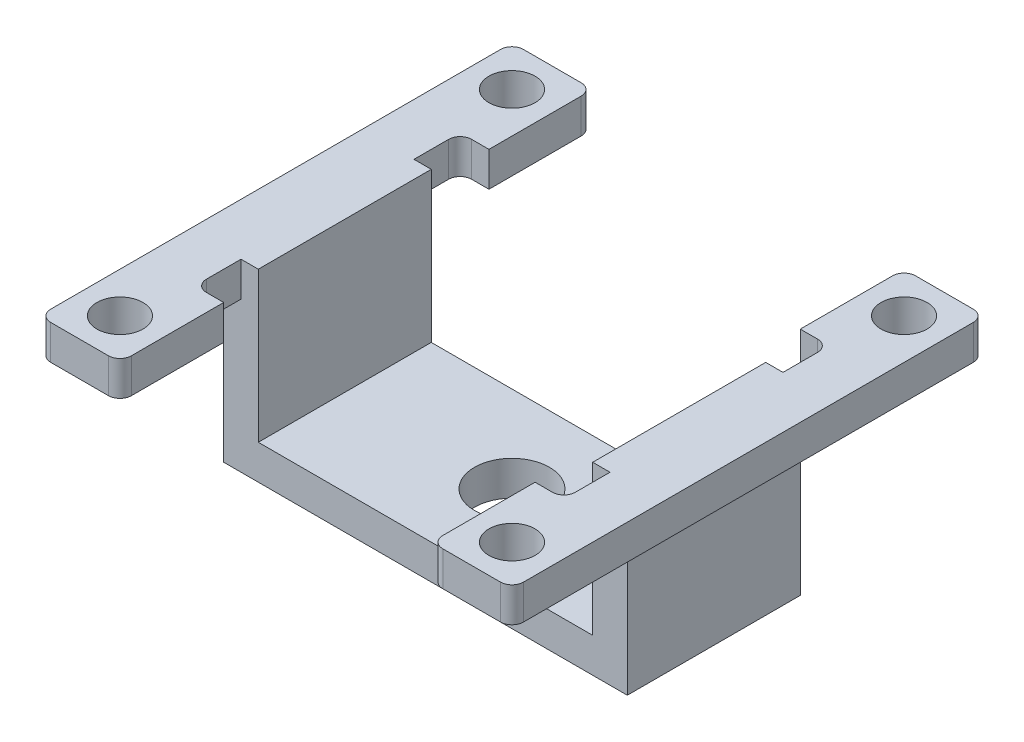
from build123d import *

# Parameters (mm, degrees)
SKETCH_1_R      = 3.25
EXTRUDE_1_DEPTH = 3
SKETCH_2_W      = 3
SKETCH_2_H      = 15
EXTRUDE_2_DEPTH = 10
SKETCH_3_R      = 2
EXTRUDE_3_DEPTH = 3


with BuildPart() as part:
    # 草图1 → 凸台-拉伸1 (new body)
    with BuildSketch(Plane(origin=(0, 0, 0), x_dir=(1, 0, 0), z_dir=(0, 1, 0))):
        Polygon((-12.5, 7.5), (12.5, 7.5), (17.5, 7.5), (17.5, -7.5), (12.5, -7.5), (-12.5, -7.5), (-17.5, -7.5), (-17.5, 7.5), align=None)
        with Locations(Location((0, 0, 0), (0, 0, 270))):
            Circle(SKETCH_1_R, mode=Mode.SUBTRACT)
    extrude(amount=EXTRUDE_1_DEPTH)

    # 草图2 → 凸台-拉伸2 (add)
    with BuildSketch(Plane(origin=(0, 3, 0), x_dir=(1, 0, 0), z_dir=(0, 1, 0))):
        with Locations((-16, 0)):
            Rectangle(SKETCH_2_W, SKETCH_2_H)
        with Locations((16, 0)):
            Rectangle(SKETCH_2_W, SKETCH_2_H)
    extrude(amount=EXTRUDE_2_DEPTH)

    # 草图3 → 凸台-拉伸3 (add)
    # profile 1 of 2: a face of its own
    with BuildSketch(Plane(origin=(0, 13, 0), x_dir=(1, 0, 0), z_dir=(0, 1, 0))):
        with BuildLine():
            Line((-15, -11.5), (-13.5, -11.5))
            Line((-13.5, -11.5), (-13.5, -17.5))
            Line((-13.5, -17.5), (-13.5, -19.5))
            ThreePointArc((-13.5, -19.5), (-13.792893219, -20.207106781), (-14.5, -20.5))
            Line((-14.5, -20.5), (-19.5, -20.5))
            ThreePointArc((-19.5, -20.5), (-20.207106781, -20.207106781), (-20.5, -19.5))
            Line((-20.5, -19.5), (-20.5, 19.5))
            ThreePointArc((-20.5, 19.5), (-20.207106781, 20.207106781), (-19.5, 20.5))
            Line((-19.5, 20.5), (-14.5, 20.5))
            ThreePointArc((-14.5, 20.5), (-13.792893219, 20.207106781), (-13.5, 19.5))
            Line((-13.5, 19.5), (-13.5, 18.5))
            Line((-13.5, 18.5), (-13.5, 11.5))
            Line((-13.5, 11.5), (-15, 11.5))
            ThreePointArc((-15, 11.5), (-15.707106781, 11.207106781), (-16, 10.5))
            Line((-16, 10.5), (-16, 7.5))
            Line((-16, 7.5), (-14.5, 7.5))
            Line((-14.5, 7.5), (-14.5, -7.5))
            Line((-14.5, -7.5), (-16, -7.5))
            Line((-16, -7.5), (-16, -10.5))
            ThreePointArc((-16, -10.5), (-15.707106781, -11.207106781), (-15, -11.5))
        make_face()
        with Locations(Location((-17, 17, 0), (0, 0, 270))):
            Circle(SKETCH_3_R, mode=Mode.SUBTRACT)
        with Locations(Location((-17, -17, 0), (0, 0, 90))):
            Circle(SKETCH_3_R, mode=Mode.SUBTRACT)
    # profile 2 of 2: a face of its own
    with BuildSketch(Plane(origin=(0, 13, 0), x_dir=(1, 0, 0), z_dir=(0, 1, 0))):
        with BuildLine():
            Line((14.5, 7.5), (16, 7.5))
            Line((16, 7.5), (16, 10.5))
            ThreePointArc((16, 10.5), (15.707106781, 11.207106781), (15, 11.5))
            Line((15, 11.5), (13.5, 11.5))
            Line((13.5, 11.5), (13.5, 18.5))
            Line((13.5, 18.5), (13.5, 19.5))
            ThreePointArc((13.5, 19.5), (13.792893219, 20.207106781), (14.5, 20.5))
            Line((14.5, 20.5), (19.5, 20.5))
            ThreePointArc((19.5, 20.5), (20.207106781, 20.207106781), (20.5, 19.5))
            Line((20.5, 19.5), (20.5, -19.5))
            ThreePointArc((20.5, -19.5), (20.207106781, -20.207106781), (19.5, -20.5))
            Line((19.5, -20.5), (14.5, -20.5))
            ThreePointArc((14.5, -20.5), (13.792893219, -20.207106781), (13.5, -19.5))
            Line((13.5, -19.5), (13.5, -18.5))
            Line((13.5, -18.5), (13.5, -11.5))
            Line((13.5, -11.5), (15, -11.5))
            ThreePointArc((15, -11.5), (15.707106781, -11.207106781), (16, -10.5))
            Line((16, -10.5), (16, -7.5))
            Line((16, -7.5), (14.5, -7.5))
            Line((14.5, -7.5), (14.5, 7.5))
        make_face()
        with Locations(Location((17, 17, 0), (0, 0, 90))):
            Circle(SKETCH_3_R, mode=Mode.SUBTRACT)
        with Locations(Location((17, -17, 0), (0, 0, 270))):
            Circle(SKETCH_3_R, mode=Mode.SUBTRACT)
    extrude(amount=EXTRUDE_3_DEPTH)


solid = part.part
